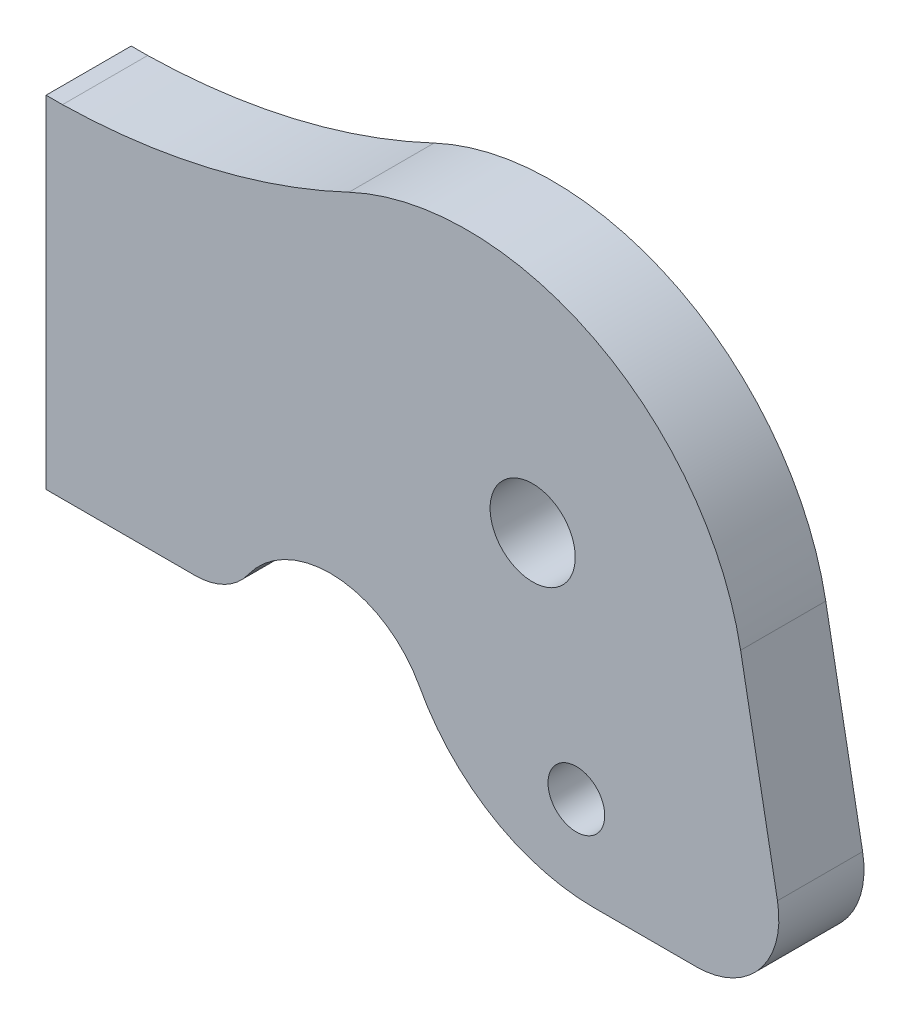
from build123d import *

# Parameters (mm, degrees)
SKETCH1_R           = 1
SKETCH1_R_2         = 1.5
BOSS_EXTRUDE1_DEPTH = 3


with BuildPart() as part:
    # Sketch1 → Boss-Extrude1 (new body)
    with BuildSketch(Plane.XY):
        with BuildLine():
            Line((6.869152375, -4.974037541), (5.570032573, 2.020702591))
            ThreePointArc((5.570032573, 2.020702591), (0.408013999, 8.949092219), (-8.230691413, 9.096697763))
            ThreePointArc((-8.230691413, 9.096697763), (-8.247364434, 9.088837268), (-8.264022634, 9.080945414))
            ThreePointArc((-8.264022634, 9.080945414), (-13.168452035, 7.370807944), (-18.321933974, 6.723025711))
            Line((-18.321933974, 6.723025711), (-18.900934286, 6.723025711))
            Line((-18.900934286, 6.723025711), (-18.900934286, -5.309936566))
            Line((-18.900934286, -5.309936566), (-13.651422395, -5.309936566))
            ThreePointArc((-13.651422395, -5.309936566), (-12.600650913, -5.055458479), (-11.78274174, -4.34841931))
            ThreePointArc((-11.78274174, -4.34841931), (-8.658711941, -2.8651804), (-5.749146129, -4.734401261))
            ThreePointArc((-5.749146129, -4.734401261), (-3.178332185, -7.427632658), (0.410473142, -8.419124472))
            Line((0.410473142, -8.419124472), (4.004999648, -8.419124472))
            ThreePointArc((4.004999648, -8.419124472), (6.245088642, -7.368341001), (6.869152375, -4.974037541))
        make_face()
        with Locations((-0.216717362, -5.419124472)):
            Circle(SKETCH1_R, mode=Mode.SUBTRACT)
        with Locations((-1.756717362, 1.940875528)):
            Circle(SKETCH1_R_2, mode=Mode.SUBTRACT)
    extrude(amount=BOSS_EXTRUDE1_DEPTH)


solid = part.part
